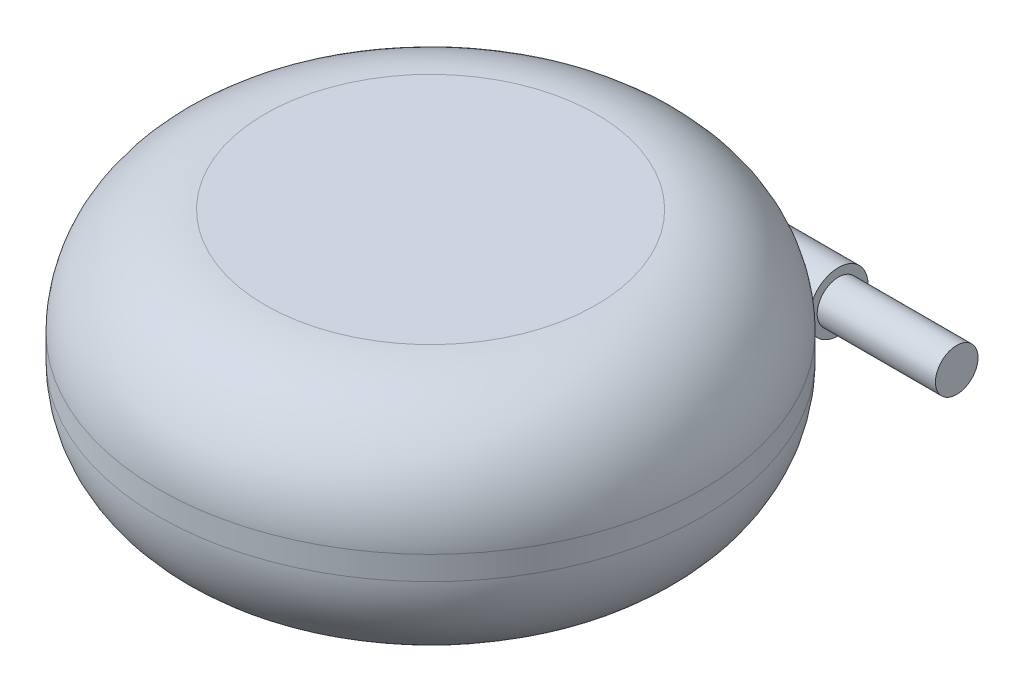
from build123d import *

# Parameters (mm, degrees)
SKETCH1_R           = 29.21
BOSS_EXTRUDE1_DEPTH = 25.4
FILLET1_R           = 11.43
SKETCH2_R           = 3.175
BOSS_EXTRUDE2_DEPTH = 17.78
SKETCH3_R           = 2.286
BOSS_EXTRUDE3_DEPTH = 12.7


with BuildPart() as part:
    # Sketch1 → Boss-Extrude1 (new body)
    with BuildSketch(Plane(origin=(0, 0, 0), x_dir=(1, 0, 0), z_dir=(0, 1, 0))):
        with Locations(Location((0, 0, 0), (0, 0, 270))):
            Circle(SKETCH1_R)
    extrude(amount=BOSS_EXTRUDE1_DEPTH)

    # Fillet1
    fillet1_edges = [part.edges().sort_by_distance(p)[0] for p in [
        (0, 0, -29.21),
        (0, 25.4, -29.21),
    ]]
    fillet(fillet1_edges, radius=FILLET1_R)

    # Sketch2 → Boss-Extrude2 (add)
    with BuildSketch(Plane(origin=(0, 0, 0), x_dir=(0, 0, -1), z_dir=(1, 0, 0))):
        with Locations((26.035, 12.7)):
            Circle(SKETCH2_R)
    extrude(amount=BOSS_EXTRUDE2_DEPTH)

    # Sketch3 → Boss-Extrude3 (add)
    with BuildSketch(Plane(origin=(17.78, 0, 0), x_dir=(0, 0, -1), z_dir=(1, 0, 0))):
        with Locations((26.035, 12.7)):
            Circle(SKETCH3_R)
    extrude(amount=BOSS_EXTRUDE3_DEPTH)


solid = part.part
